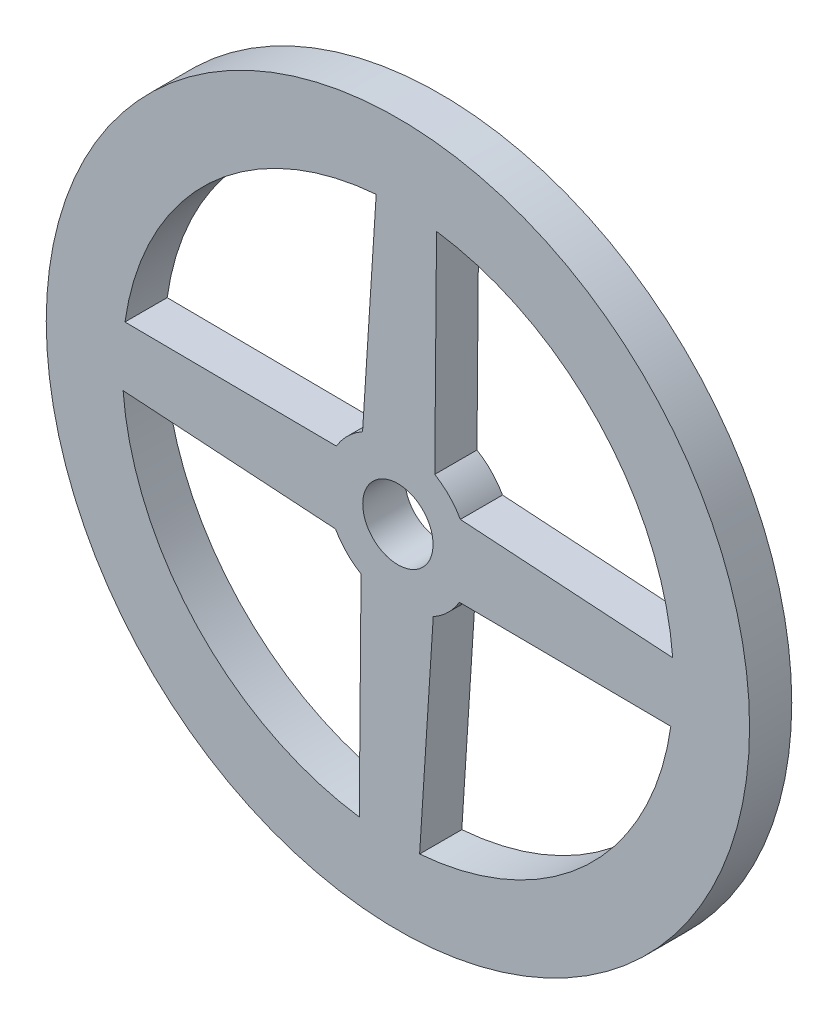
from build123d import *

# Parameters (mm, degrees)
SKETCH1_R               = 25
BOSS_EXTRUDE1_DEPTH     = 3
CUT_EXTRUDE1_DEPTH      = 36.482389998
CUT_EXTRUDE1_DEPTH_BACK = 36.482389998
SKETCH2_R               = 2.5


with BuildPart() as part:
    # Sketch1 → Boss-Extrude1 (new body)
    with BuildSketch(Plane.XY):
        Circle(SKETCH1_R)
        with BuildLine():
            Line((2.745911262, 19.401997604), (2.620473901, 4.376040727))
            ThreePointArc((2.620473901, 4.376040727), (3.650596033, 3.562269574), (4.438897848, 2.512528966))
            Line((4.438897848, 2.512528966), (19.534473328, 1.54333777))
            ThreePointArc((19.534473328, 1.54333777), (14.277143171, 13.42165126), (2.745911262, 19.401997604))
        make_face(mode=Mode.SUBTRACT)
        with BuildLine():
            Line((2.512528966, -4.438897848), (1.54333777, -19.534473328))
            ThreePointArc((1.54333777, -19.534473328), (13.42165126, -14.277143171), (19.401997604, -2.745911262))
            Line((19.401997604, -2.745911262), (4.376040727, -2.620473901))
            ThreePointArc((4.376040727, -2.620473901), (3.562269574, -3.650596033), (2.512528966, -4.438897848))
        make_face(mode=Mode.SUBTRACT)
        with BuildLine():
            Line((-4.438897848, -2.512528966), (-19.534473328, -1.54333777))
            ThreePointArc((-19.534473328, -1.54333777), (-14.277143171, -13.42165126), (-2.745911262, -19.401997604))
            Line((-2.745911262, -19.401997604), (-2.620473901, -4.376040727))
            ThreePointArc((-2.620473901, -4.376040727), (-3.650596033, -3.562269574), (-4.438897848, -2.512528966))
        make_face(mode=Mode.SUBTRACT)
        with BuildLine():
            Line((-2.512528966, 4.438897848), (-1.54333777, 19.534473328))
            ThreePointArc((-1.54333777, 19.534473328), (-13.42165126, 14.277143171), (-19.401997604, 2.745911262))
            Line((-19.401997604, 2.745911262), (-4.376040727, 2.620473901))
            ThreePointArc((-4.376040727, 2.620473901), (-3.562269574, 3.650596033), (-2.512528966, 4.438897848))
        make_face(mode=Mode.SUBTRACT)
    extrude(amount=BOSS_EXTRUDE1_DEPTH)

    # Sketch2 → Cut-Extrude1 (cut, two sides: drawn at the far end of the back side and taken through both)
    with BuildSketch(Plane(origin=(0, 0, 0), x_dir=(-1, 0, 0), z_dir=(0, 0, -1)).offset(-CUT_EXTRUDE1_DEPTH_BACK)):
        Circle(SKETCH2_R)
    extrude(amount=CUT_EXTRUDE1_DEPTH + CUT_EXTRUDE1_DEPTH_BACK, mode=Mode.SUBTRACT)


solid = part.part
